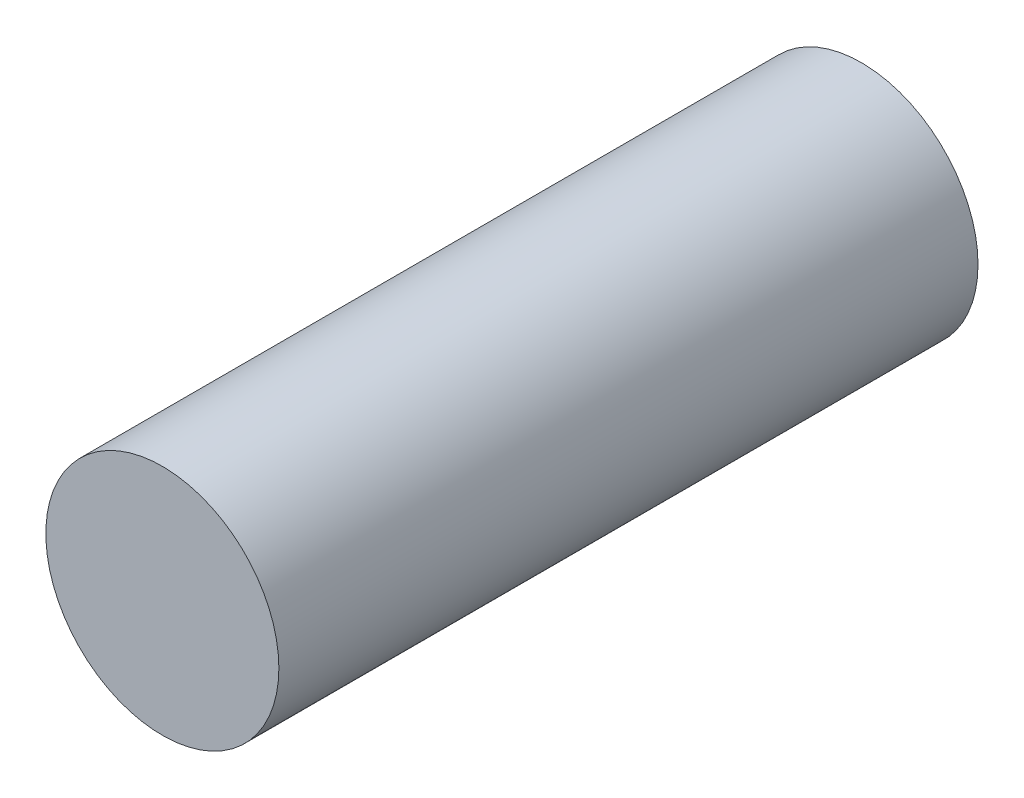
from build123d import *

# Parameters (mm, degrees)
SKETCH1_R           = 12.5
BOSS_EXTRUDE1_DEPTH = 37.5


with BuildPart() as part:
    # Sketch1 → Boss-Extrude1 (new, symmetric)
    with BuildSketch(Plane.XY):
        Circle(SKETCH1_R)
    extrude(amount=BOSS_EXTRUDE1_DEPTH, both=True)


solid = part.part
